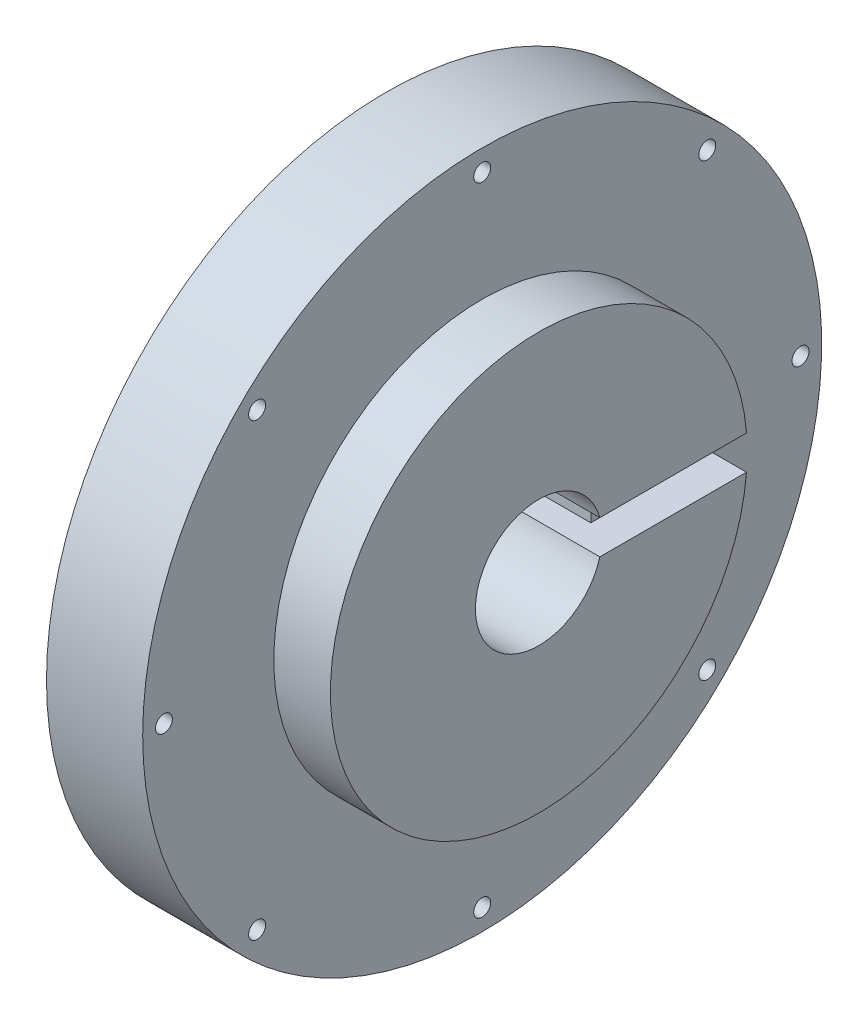
from build123d import *

# Parameters (mm, degrees)
UPPER_CIRLCE_2_R   = 36.83
UPPER_CIRLCE_DEPTH = 10
SKETCH2_R          = 1.5
CUT_EXTRUDE1_DEPTH = 137.863810045
CIRPATTERN1_COUNT  = 8
PIN_SKETCH_R       = 2
CUT_EXTRUDE2_DEPTH = 10
SKETCH3_R          = 11.2
CUT_EXTRUDE3_DEPTH = 29
SKETCH4_W          = 8
SKETCH4_H          = 6
CUT_EXTRUDE4_DEPTH = 70
SKETCH6_W          = 22.346517692
SKETCH6_H          = 6
CUT_EXTRUDE5_DEPTH = 6
SKETCH7_W          = 17.189641189
SKETCH7_H          = 6
CUT_EXTRUDE6_DEPTH = 4


with BuildPart() as part:
    # Sketch1 → Revolve1 (revolve)
    with BuildSketch(Plane.XY, mode=Mode.PRIVATE) as revolve1_sk:
        Polygon((0, 0), (-17, 0), (-17, 25), (-27.05, 25), (-27.05, 60), (0, 60), align=None)
    revolve(revolve1_sk.sketch.rotate(Axis((-27.05, 60, 0), (1, 0, 0)), 270), axis=Axis((-27.05, 60, 0), (1, 0, 0)))

    # upper cirlce 2 → upper cirlce (add)
    with BuildSketch(Plane(origin=(0, 0, 0), x_dir=(0, 0, -1), z_dir=(1, 0, 0))):
        with Locations((0, 60)):
            Circle(UPPER_CIRLCE_2_R)
    extrude(amount=UPPER_CIRLCE_DEPTH)

    # Sketch2 → Cut-Extrude1 (cut, symmetric)
    with BuildSketch(Plane(origin=(0, 0, 0), x_dir=(0, 0, -1), z_dir=(1, 0, 0))):
        with Locations((0, 116.25)):
            Circle(SKETCH2_R)
    cut_extrude1 = extrude(amount=CUT_EXTRUDE1_DEPTH, both=True, mode=Mode.SUBTRACT)

    # CirPattern1: Cut-Extrude1 ×8 about axis
    cirpattern1_axis = Axis((0, 60, 0), (1, 0, 0))
    for i in range(1, CIRPATTERN1_COUNT):
        add(cut_extrude1.rotate(cirpattern1_axis, i * 360 / CIRPATTERN1_COUNT), mode=Mode.SUBTRACT)

    # pin sketch → Cut-Extrude2 (cut)
    with BuildSketch(Plane.ZY.offset(27.05)):
        with Locations((-18.56, 78.56)):
            Circle(PIN_SKETCH_R)
        with Locations((18.56, 78.56)):
            Circle(PIN_SKETCH_R)
        with Locations((18.56, 41.44)):
            Circle(PIN_SKETCH_R)
        with Locations((-18.56, 41.44)):
            Circle(PIN_SKETCH_R)
    extrude(amount=-CUT_EXTRUDE2_DEPTH, mode=Mode.SUBTRACT)

    # Sketch3 → Cut-Extrude3 (cut)
    with BuildSketch(Plane(origin=(10, 0, 0), x_dir=(0, 0, -1), z_dir=(1, 0, 0))):
        with Locations((0, 60)):
            Circle(SKETCH3_R)
    extrude(amount=-CUT_EXTRUDE3_DEPTH, mode=Mode.SUBTRACT)

    # Sketch4 → Cut-Extrude4 (cut)
    with BuildSketch(Plane(origin=(-19, 0, 0), x_dir=(0, 0, -1), z_dir=(1, 0, 0))):
        with Locations((11.2, 60)):
            Rectangle(SKETCH4_W, SKETCH4_H)
    extrude(amount=CUT_EXTRUDE4_DEPTH, mode=Mode.SUBTRACT)

    # Sketch6 → Cut-Extrude5 (cut)
    with BuildSketch(Plane(origin=(10, 0, 0), x_dir=(0, 0, -1), z_dir=(1, 0, 0))):
        with Locations((26.373258846, 60)):
            Rectangle(SKETCH6_W, SKETCH6_H)
    extrude(amount=-CUT_EXTRUDE5_DEPTH, mode=Mode.SUBTRACT)

    # Sketch7 → Cut-Extrude6 (cut)
    with BuildSketch(Plane(origin=(-19, 0, 0), x_dir=(0, 0, -1), z_dir=(1, 0, 0))):
        with Locations((6.605179406, 60)):
            Rectangle(SKETCH7_W, SKETCH7_H)
    extrude(amount=-CUT_EXTRUDE6_DEPTH, mode=Mode.SUBTRACT)


solid = part.part
